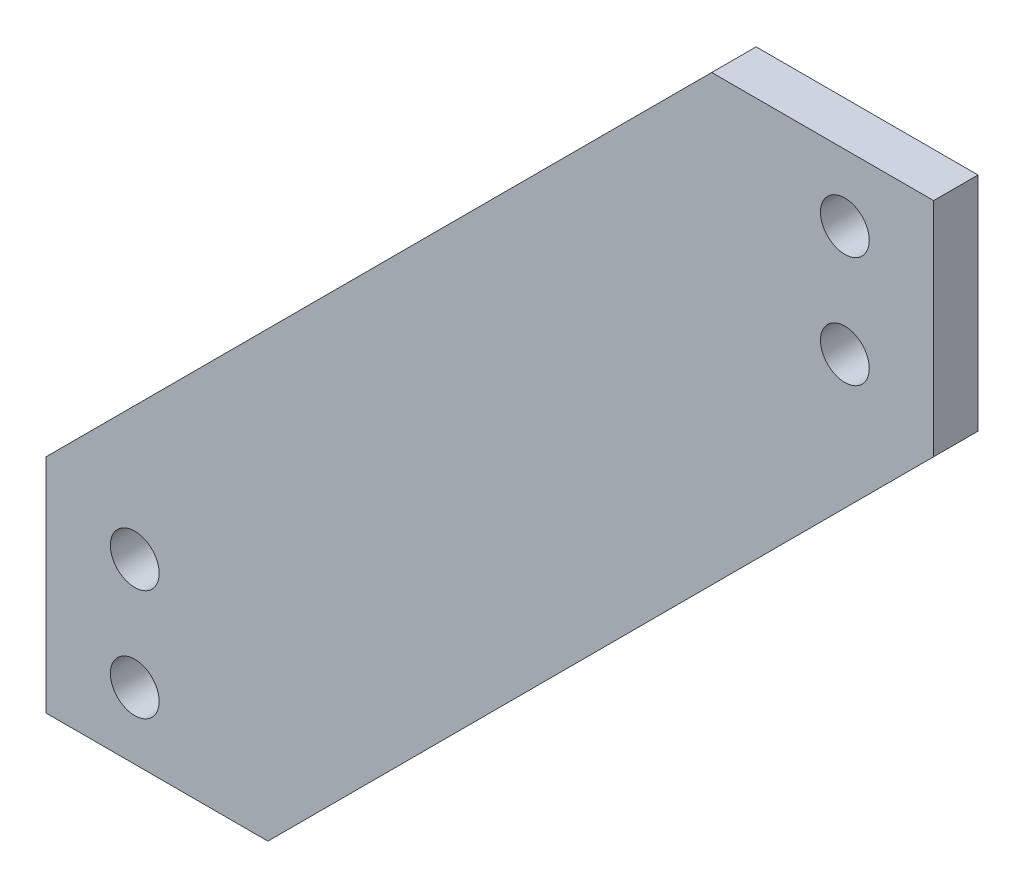
from build123d import *

# Parameters (mm, degrees)
BOSS_EXTRUDE1_DEPTH  = 5
BOSS_EXTRUDE2_DEPTH  = 5
M5_CLEARANCE_HOLE1_D = 5.5


with BuildPart() as part:
    # Sketch1 → Boss-Extrude1 (new body)
    with BuildSketch(Plane.XY):
        Polygon((0, 0), (20, 0), (100, 100), (80, 100), align=None)
    extrude(amount=BOSS_EXTRUDE1_DEPTH)

    # Sketch2 → Boss-Extrude2 (add)
    with BuildSketch(Plane.XY.offset(5)):
        Polygon((0, 0), (0, 25), (75, 100), (80, 100), (100, 100), (100, 75), (25, 0), align=None)
    extrude(amount=-BOSS_EXTRUDE2_DEPTH)

    # M5 Clearance Hole1 (through all)
    with Locations(Plane.XY.offset(5)):
        with Locations((10, 20), (90, 80), (10, 7.5), (90, 92.5)):
            Hole(M5_CLEARANCE_HOLE1_D / 2)


solid = part.part
